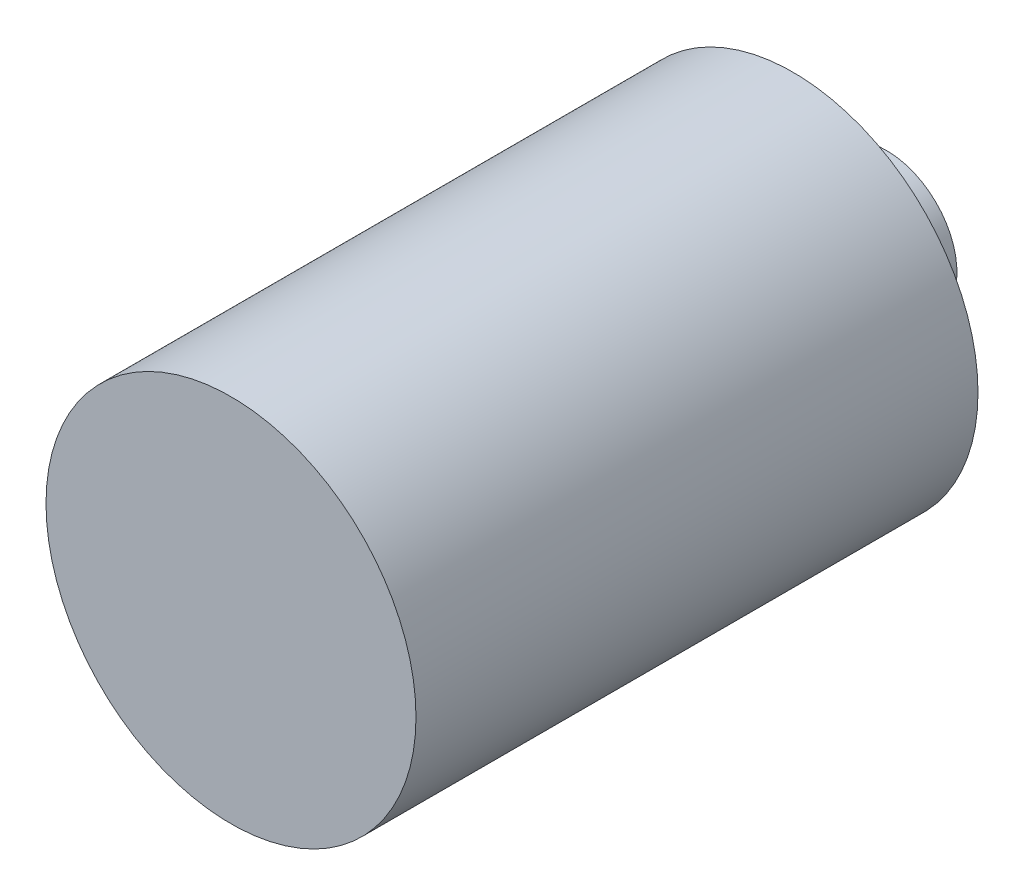
from build123d import *

# Parameters (mm, degrees)
SKETCH_1_R      = 3.95
EXTRUDE_1_DEPTH = 12
SKETCH_2_R      = 1.5
EXTRUDE_2_DEPTH = 2


with BuildPart() as part:
    # 草图1 → 凸台-拉伸1 (new body)
    with BuildSketch(Plane.XY):
        Circle(SKETCH_1_R)
    extrude(amount=EXTRUDE_1_DEPTH)

    # 草图2 → 凸台-拉伸2 (add)
    with BuildSketch(Plane(origin=(0, 0, 0), x_dir=(-1, 0, 0), z_dir=(0, 0, -1))):
        Circle(SKETCH_2_R)
    extrude(amount=EXTRUDE_2_DEPTH)


solid = part.part
